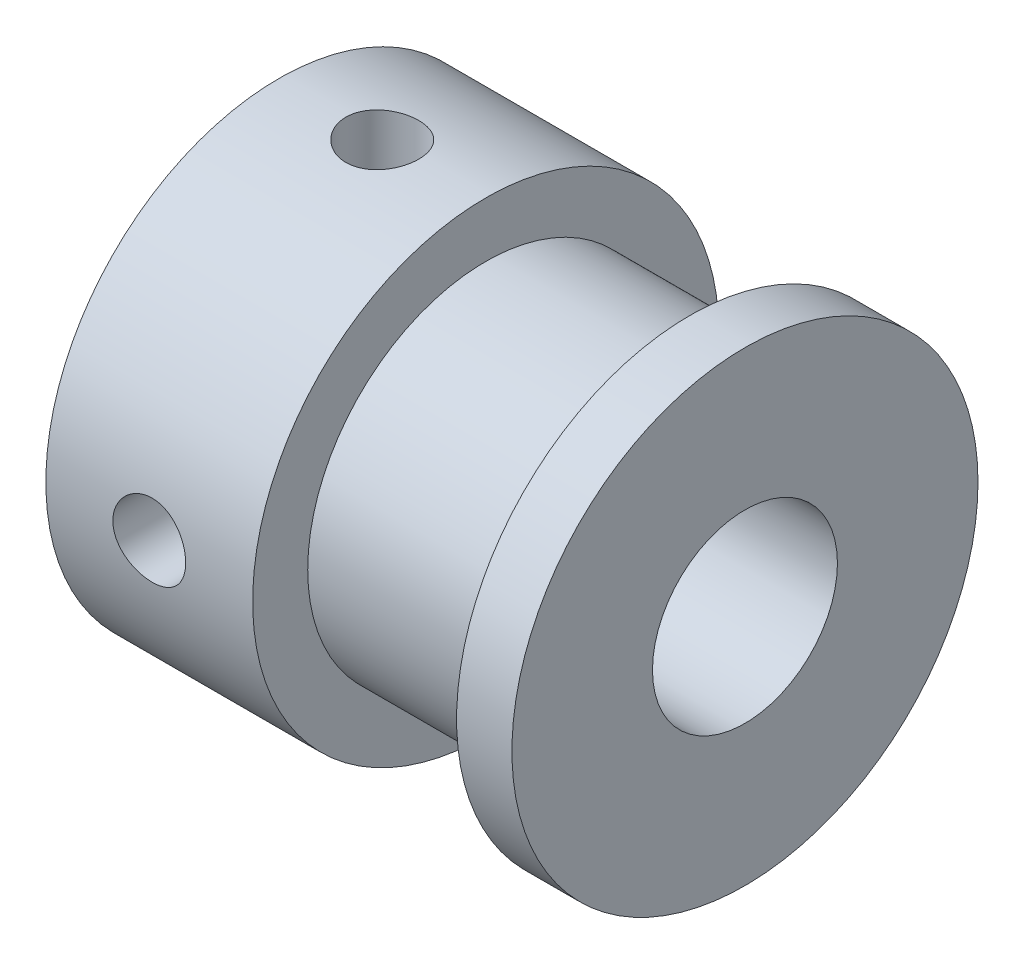
from build123d import *

# Parameters (mm, degrees)
SKETCH2_W = 1.25
SKETCH2_H = 8
SKETCH4_W = 1.25
SKETCH4_H = 8


with BuildPart() as part:
    # Sketch1 → Revolve1 (revolve)
    with BuildSketch(Plane.XY, mode=Mode.PRIVATE) as revolve1_sk:
        Polygon((0, 3.175), (0, 8), (7.1, 8), (7.1, 6.11), (14.1, 6.11), (14.1, 8), (16, 8), (16, 3.175), align=None)
    revolve(revolve1_sk.sketch.rotate(Axis((0, 0, 0), (-1, 0, 0)), 90), axis=Axis((0, 0, 0), (-1, 0, 0)))

    # Sketch2 → M3x0.5 Tapped Hole1 (revolve, cut)
    with BuildSketch(Plane(origin=(3.55, 0, 0), x_dir=(0, 0, -1), z_dir=(1, 0, 0))):
        with Locations((0.625, 4)):
            Rectangle(SKETCH2_W, SKETCH2_H)
    revolve(axis=Axis((3.55, -6.35, 0), (0, 1, 0)), mode=Mode.SUBTRACT)

    # Sketch4 → M3x0.5 Tapped Hole2 (revolve, cut)
    with BuildSketch(Plane.YZ.offset(3.55)):
        with Locations((0.625, 4)):
            Rectangle(SKETCH4_W, SKETCH4_H)
    revolve(axis=Axis((3.55, 0, -6.35), (0, 0, 1)), mode=Mode.SUBTRACT)


solid = part.part
